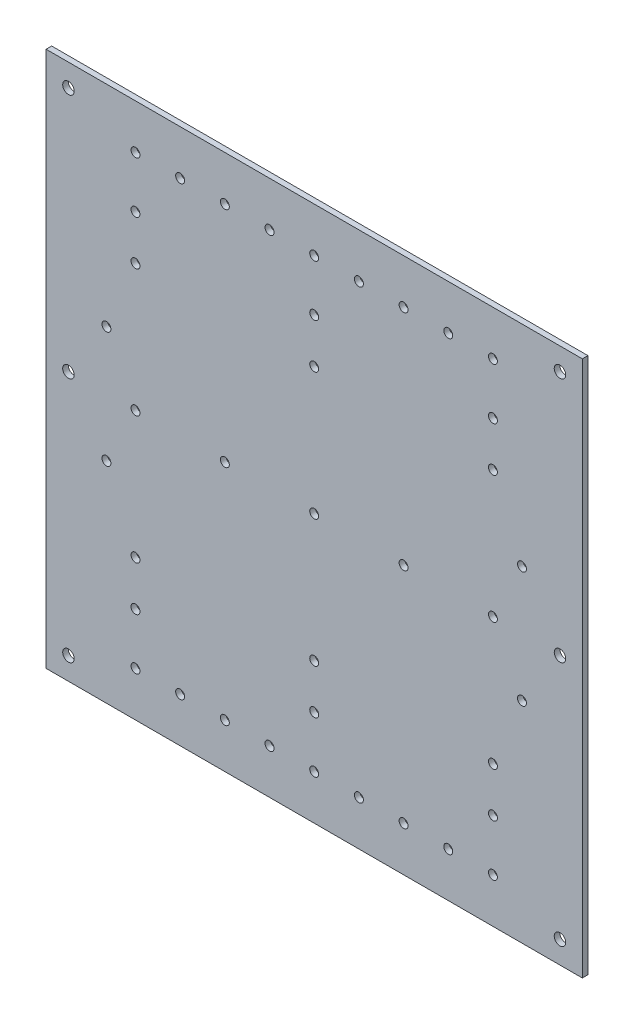
from build123d import *

# Parameters (mm, degrees)
SKETCH1_W           = 304.8
SKETCH1_H           = 304.8
SKETCH1_R           = 2.5527
SKETCH1_R_2         = 2.54
SKETCH1_R_3         = 3.2639
BOSS_EXTRUDE1_DEPTH = 3.175


with BuildPart() as part:
    # Sketch1 → Boss-Extrude1 (new body)
    with BuildSketch(Plane.XY):
        Rectangle(SKETCH1_W, SKETCH1_H)
        with Locations((-76.2, 127)):
            Circle(SKETCH1_R, mode=Mode.SUBTRACT)
        with Locations((-25.4, 127)):
            Circle(SKETCH1_R, mode=Mode.SUBTRACT)
        with Locations((25.4, 127)):
            Circle(SKETCH1_R, mode=Mode.SUBTRACT)
        with Locations((76.2, 127)):
            Circle(SKETCH1_R, mode=Mode.SUBTRACT)
        with Locations((-101.6, 0)):
            Circle(SKETCH1_R_2, mode=Mode.SUBTRACT)
        with Locations((-50.8, 0)):
            Circle(SKETCH1_R_2, mode=Mode.SUBTRACT)
        Circle(SKETCH1_R_2, mode=Mode.SUBTRACT)
        with Locations((101.6, 0)):
            Circle(SKETCH1_R_2, mode=Mode.SUBTRACT)
        with Locations((50.8, 0)):
            Circle(SKETCH1_R_2, mode=Mode.SUBTRACT)
        with Locations((-50.8, 127)):
            Circle(SKETCH1_R_2, mode=Mode.SUBTRACT)
        with Locations((0, 127)):
            Circle(SKETCH1_R_2, mode=Mode.SUBTRACT)
        with Locations((50.8, 127)):
            Circle(SKETCH1_R_2, mode=Mode.SUBTRACT)
        with Locations((-101.6, 72.39)):
            Circle(SKETCH1_R_2, mode=Mode.SUBTRACT)
        with Locations((0, 72.39)):
            Circle(SKETCH1_R_2, mode=Mode.SUBTRACT)
        with Locations((101.6, 72.39)):
            Circle(SKETCH1_R_2, mode=Mode.SUBTRACT)
        with Locations((-101.6, -72.39)):
            Circle(SKETCH1_R_2, mode=Mode.SUBTRACT)
        with Locations((0, -72.39)):
            Circle(SKETCH1_R_2, mode=Mode.SUBTRACT)
        with Locations((101.6, -72.39)):
            Circle(SKETCH1_R_2, mode=Mode.SUBTRACT)
        with Locations((-76.2, -127)):
            Circle(SKETCH1_R, mode=Mode.SUBTRACT)
        with Locations((-25.4, -127)):
            Circle(SKETCH1_R, mode=Mode.SUBTRACT)
        with Locations((25.4, -127)):
            Circle(SKETCH1_R, mode=Mode.SUBTRACT)
        with Locations((76.2, -127)):
            Circle(SKETCH1_R, mode=Mode.SUBTRACT)
        with Locations((50.8, -127)):
            Circle(SKETCH1_R_2, mode=Mode.SUBTRACT)
        with Locations((0, -127)):
            Circle(SKETCH1_R_2, mode=Mode.SUBTRACT)
        with Locations((-50.8, -127)):
            Circle(SKETCH1_R_2, mode=Mode.SUBTRACT)
        with Locations((-101.6, 97.79)):
            Circle(SKETCH1_R_2, mode=Mode.SUBTRACT)
        with Locations((0, 97.79)):
            Circle(SKETCH1_R_2, mode=Mode.SUBTRACT)
        with Locations((101.6, 97.79)):
            Circle(SKETCH1_R_2, mode=Mode.SUBTRACT)
        with Locations((101.6, 127)):
            Circle(SKETCH1_R_2, mode=Mode.SUBTRACT)
        with Locations((-101.6, 127)):
            Circle(SKETCH1_R_2, mode=Mode.SUBTRACT)
        with Locations((-118.11, 33.02)):
            Circle(SKETCH1_R_2, mode=Mode.SUBTRACT)
        with Locations((-101.6, -127)):
            Circle(SKETCH1_R_2, mode=Mode.SUBTRACT)
        with Locations((101.6, -127)):
            Circle(SKETCH1_R_2, mode=Mode.SUBTRACT)
        with Locations((101.6, -97.79)):
            Circle(SKETCH1_R_2, mode=Mode.SUBTRACT)
        with Locations((0, -97.79)):
            Circle(SKETCH1_R_2, mode=Mode.SUBTRACT)
        with Locations((-101.6, -97.79)):
            Circle(SKETCH1_R_2, mode=Mode.SUBTRACT)
        with Locations((-118.11, -33.02)):
            Circle(SKETCH1_R_2, mode=Mode.SUBTRACT)
        with Locations((-139.7, 139.7)):
            Circle(SKETCH1_R_3, mode=Mode.SUBTRACT)
        with Locations((-139.7, 0)):
            Circle(SKETCH1_R_3, mode=Mode.SUBTRACT)
        with Locations((-139.7, -139.7)):
            Circle(SKETCH1_R_3, mode=Mode.SUBTRACT)
        with Locations((139.7, -139.7)):
            Circle(SKETCH1_R_3, mode=Mode.SUBTRACT)
        with Locations((139.7, 0)):
            Circle(SKETCH1_R_3, mode=Mode.SUBTRACT)
        with Locations((139.7, 139.7)):
            Circle(SKETCH1_R_3, mode=Mode.SUBTRACT)
        with Locations((118.11, -33.02)):
            Circle(SKETCH1_R_2, mode=Mode.SUBTRACT)
        with Locations((118.11, 33.02)):
            Circle(SKETCH1_R_2, mode=Mode.SUBTRACT)
    extrude(amount=BOSS_EXTRUDE1_DEPTH)


solid = part.part
